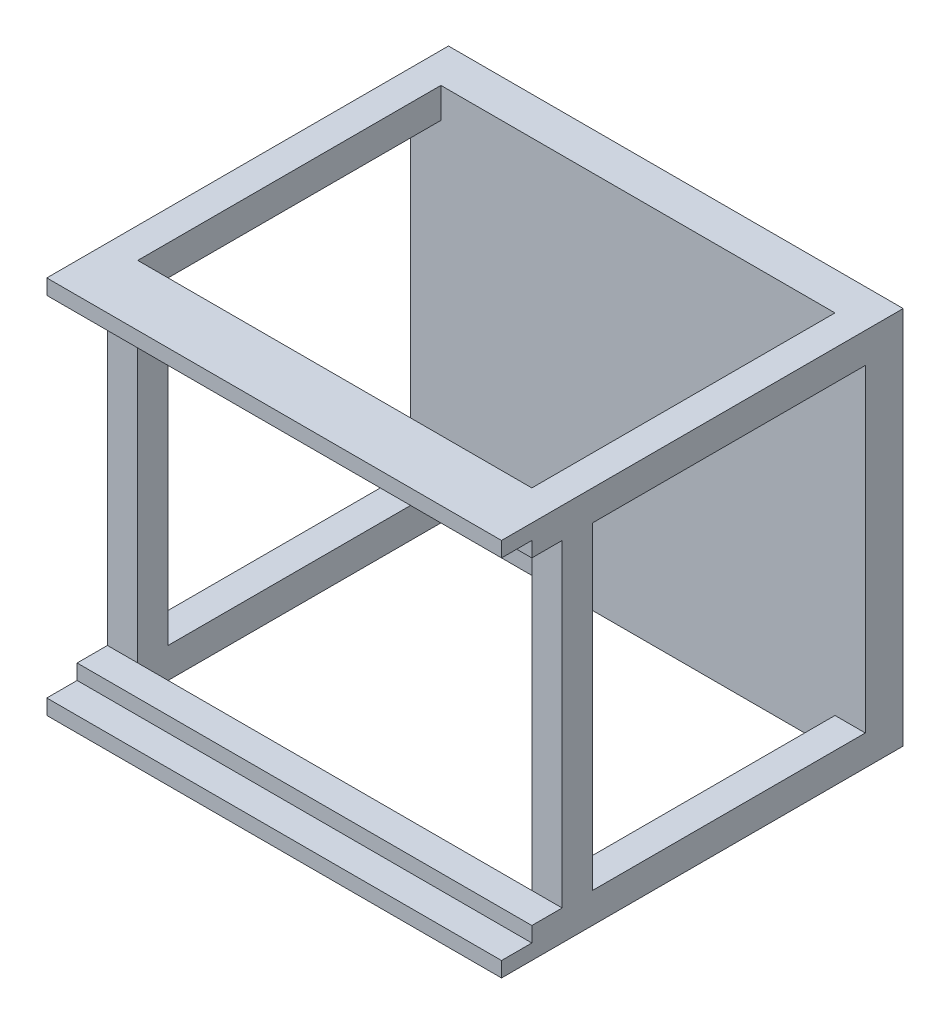
from build123d import *

# Parameters (mm, degrees)
SKETCH_1_W       = 300
SKETCH_1_H       = 250
EXTRUDE_1_DEPTH  = 25
SKETCH_2_W       = 20
SKETCH_2_H       = 20
EXTRUDE_3_DEPTH  = 200
SKETCH_3_W       = 20
SKETCH_3_H       = 20
EXTRUDE_4_DEPTH  = 20
SKETCH_4_W       = 20
SKETCH_4_H       = 20
EXTRUDE_5_DEPTH  = 20
SKETCH_5_W       = 20
SKETCH_5_H       = 20
EXTRUDE_6_DEPTH  = 20
SKETCH_6_W       = 20
SKETCH_6_H       = 20
EXTRUDE_7_DEPTH  = 20
EXTRUDE_8_REACH  = 450.247
SKETCH_8_W       = 20
SKETCH_8_H       = 20
EXTRUDE_9_REACH  = 452.472
SKETCH_9_W       = 20
SKETCH_9_H       = 20
SKETCH_10_W      = 300
SKETCH_10_H      = 10
EXTRUDE_11_DEPTH = 20


with BuildPart() as part:
    # 草图1 → 凸台-拉伸1 (new body)
    with BuildSketch(Plane.XY):
        with Locations((150, 125)):
            Rectangle(SKETCH_1_W, SKETCH_1_H)
    extrude(amount=EXTRUDE_1_DEPTH)

    # 草图2 → 凸台-拉伸3 (add)
    with BuildSketch(Plane.XY.offset(25)):
        with Locations((10, 10)):
            Rectangle(SKETCH_2_W, SKETCH_2_H)
        with Locations((10, 240)):
            Rectangle(SKETCH_2_W, SKETCH_2_H)
        with Locations((290, 240)):
            Rectangle(SKETCH_2_W, SKETCH_2_H)
        with Locations((290, 10)):
            Rectangle(SKETCH_2_W, SKETCH_2_H)
    extrude(amount=EXTRUDE_3_DEPTH)

    # 草图3 → 凸台-拉伸4 (add)
    with BuildSketch(Plane.XY.offset(225)):
        with Locations((10, 10)):
            Rectangle(SKETCH_3_W, SKETCH_3_H)
    extrude(amount=EXTRUDE_4_DEPTH)

    # 草图4 → 凸台-拉伸5 (add)
    with BuildSketch(Plane.XY.offset(225)):
        with Locations((290, 10)):
            Rectangle(SKETCH_4_W, SKETCH_4_H)
    extrude(amount=EXTRUDE_5_DEPTH)

    # 草图5 → 凸台-拉伸6 (add)
    with BuildSketch(Plane.XY.offset(225)):
        with Locations((290, 240)):
            Rectangle(SKETCH_5_W, SKETCH_5_H)
    extrude(amount=EXTRUDE_6_DEPTH)

    # 草图6 → 凸台-拉伸7 (add)
    with BuildSketch(Plane.XY.offset(225)):
        with Locations((10, 240)):
            Rectangle(SKETCH_6_W, SKETCH_6_H)
    extrude(amount=EXTRUDE_7_DEPTH)

    # 草图8 → 凸台-拉伸8 (add, up to next)
    with BuildSketch(Plane(origin=(20, 0, 0), x_dir=(0, 0, -1), z_dir=(1, 0, 0)), mode=Mode.PRIVATE) as extrude_8_sk1:
        with Locations((-235, 10)):
            Rectangle(SKETCH_8_W, SKETCH_8_H)
    extrude_8_tool1 = extrude(extrude_8_sk1.sketch, amount=EXTRUDE_8_REACH, mode=Mode.PRIVATE) - part.part
    # 草图8 → 凸台-拉伸8 (add, up to next)
    with BuildSketch(Plane(origin=(20, 0, 0), x_dir=(0, 0, -1), z_dir=(1, 0, 0)), mode=Mode.PRIVATE) as extrude_8_sk2:
        with Locations((-235, 240)):
            Rectangle(SKETCH_8_W, SKETCH_8_H)
    extrude_8_tool2 = extrude(extrude_8_sk2.sketch, amount=EXTRUDE_8_REACH, mode=Mode.PRIVATE) - part.part
    add(extrude_8_tool1.solids().sort_by_distance((20, 10, 235))[0])
    add(extrude_8_tool2.solids().sort_by_distance((20, 240, 235))[0])

    # 草图9 → 凸台-拉伸9 (add, up to next)
    with BuildSketch(Plane(origin=(0, 230, 0), x_dir=(-1, 0, 0), z_dir=(0, -1, 0)), mode=Mode.PRIVATE) as extrude_9_sk1:
        with Locations((-10, -215)):
            Rectangle(SKETCH_9_W, SKETCH_9_H)
    extrude_9_tool1 = extrude(extrude_9_sk1.sketch, amount=EXTRUDE_9_REACH, mode=Mode.PRIVATE) - part.part
    # 草图9 → 凸台-拉伸9 (add, up to next)
    with BuildSketch(Plane(origin=(0, 230, 0), x_dir=(-1, 0, 0), z_dir=(0, -1, 0)), mode=Mode.PRIVATE) as extrude_9_sk2:
        with Locations((-290, -215)):
            Rectangle(SKETCH_9_W, SKETCH_9_H)
    extrude_9_tool2 = extrude(extrude_9_sk2.sketch, amount=EXTRUDE_9_REACH, mode=Mode.PRIVATE) - part.part
    add(extrude_9_tool1.solids().sort_by_distance((10, 230, 215))[0])
    add(extrude_9_tool2.solids().sort_by_distance((290, 230, 215))[0])

    # 草图10 → 凸台-拉伸11 (add)
    with BuildSketch(Plane.XY.offset(245)):
        with Locations((150, 245)):
            Rectangle(SKETCH_10_W, SKETCH_10_H)
        with Locations((150, 5)):
            Rectangle(SKETCH_10_W, SKETCH_10_H)
    extrude(amount=EXTRUDE_11_DEPTH)


solid = part.part
